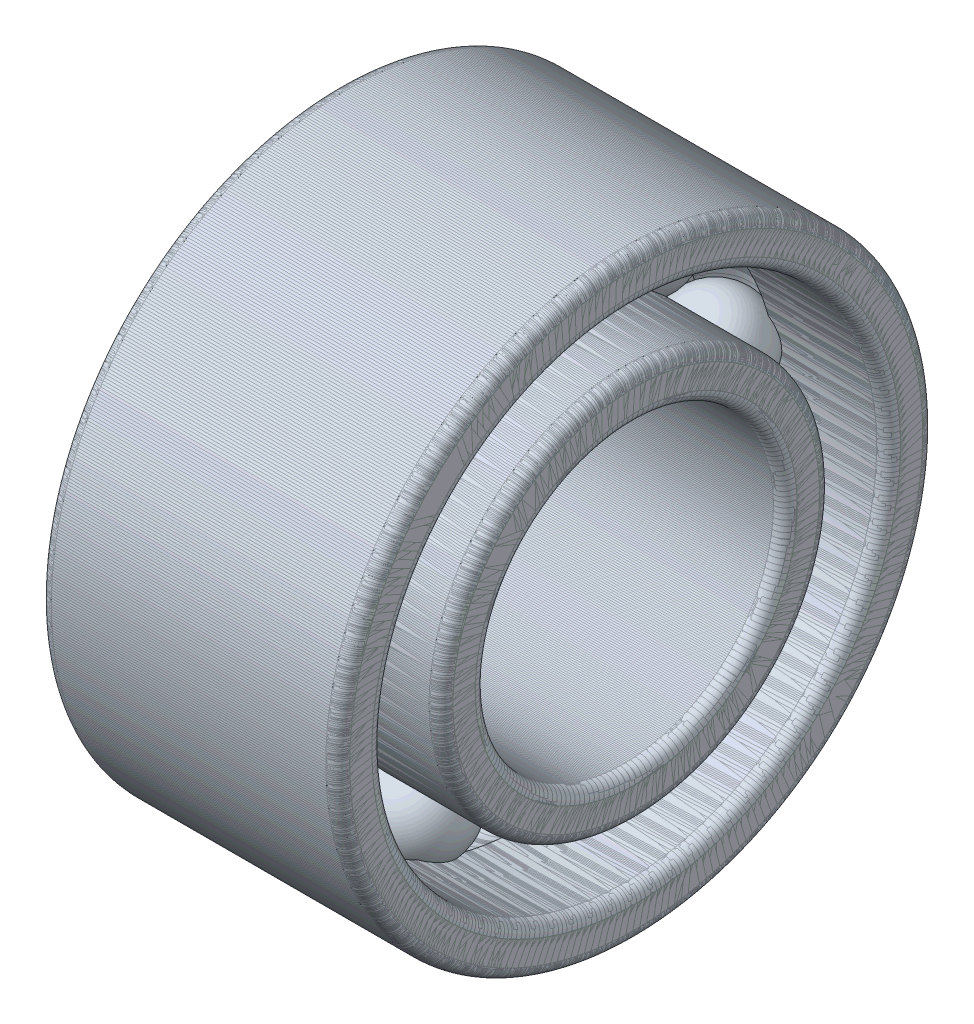
from build123d import *

# Parameters (mm, degrees)
SKETCH1_R             = 31.75
SKETCH1_R_2           = 26.8605
BOSS_EXTRUDE1_DEPTH   = 15.875
SKETCH1_R_3           = 20.765
SKETCH1_R_4           = 15.875
BOSS_EXTRUDE1_2_DEPTH = 15.875
FILLET1_R             = 1.27
FILLET2_R             = 1.27
SKETCH2_R             = 5.08
CIRPATTERN1_COUNT     = 9


with BuildPart() as part:
    # Sketch1 → Boss-Extrude1 (new, symmetric)
    with BuildSketch(Plane(origin=(0, 0, 0), x_dir=(0, 0, -1), z_dir=(1, 0, 0))):
        Circle(SKETCH1_R)
        Circle(SKETCH1_R_2, mode=Mode.SUBTRACT)
    extrude(amount=BOSS_EXTRUDE1_DEPTH, both=True)

    # Fillet1
    fillet1_edges = [part.edges().sort_by_distance(p)[0] for p in [
        (15.875, 0, 31.75),
        (-15.875, 0, 31.75),
        (-15.875, 0, 26.8605),
        (15.875, 0, 26.8605),
    ]]
    fillet(fillet1_edges, radius=FILLET1_R)


with BuildPart() as body_2:
    # Sketch1 → Boss-Extrude1 2 (new, symmetric)
    with BuildSketch(Plane(origin=(0, 0, 0), x_dir=(0, 0, -1), z_dir=(1, 0, 0))):
        Circle(SKETCH1_R_3)
        Circle(SKETCH1_R_4, mode=Mode.SUBTRACT)
    extrude(amount=BOSS_EXTRUDE1_2_DEPTH, both=True)

    # Fillet2
    fillet2_edges = [body_2.edges().sort_by_distance(p)[0] for p in [
        (15.875, 0, 20.765),
        (-15.875, 0, 20.765),
        (-15.875, 0, 15.875),
        (15.875, 0, 15.875),
    ]]
    fillet(fillet2_edges, radius=FILLET2_R)


with BuildPart() as cut_revolve1_tool:
    # Sketch2 → Cut-Revolve1 (revolve)
    with BuildSketch(Plane.XY):
        with Locations((0, 23.813)):
            Circle(SKETCH2_R)
    revolve(axis=Axis((0, 0, 0), (1, 0, 0)))


with BuildPart() as part_1:
    add(part.part)

    # Cut-Revolve1: cut by cut_revolve1_tool
    add(cut_revolve1_tool.part, mode=Mode.SUBTRACT)



with BuildPart() as body_2_1:
    add(body_2.part)

    # Cut-Revolve1: cut by cut_revolve1_tool
    add(cut_revolve1_tool.part, mode=Mode.SUBTRACT)


with BuildPart() as part_2:
    add(part_1.part)

    add(body_2_1.part)  # Revolve1 merges body 2
    # Sketch3 → Revolve1 (revolve)
    with BuildSketch(Plane.XY):
        with BuildLine():
            Line((0.792000564, 28.893), (0.792000564, 18.733))
            ThreePointArc((0.792000564, 18.733), (-4.287999436, 23.813), (0.792000564, 28.893))
        make_face()
    revolve(axis=Axis((0.792000564, 28.893, 0), (0, -1, 0)))


with BuildPart() as cirpattern1_1:
    # CirPattern1: pattern copy
    add(part_2.part.rotate(Axis((0, 0, 0), (1, 0, 0)), 1 * 360 / CIRPATTERN1_COUNT))


with BuildPart() as cirpattern1_2:
    # CirPattern1: pattern copy
    add(part_2.part.rotate(Axis((0, 0, 0), (1, 0, 0)), 2 * 360 / CIRPATTERN1_COUNT))


with BuildPart() as cirpattern1_3:
    # CirPattern1: pattern copy
    add(part_2.part.rotate(Axis((0, 0, 0), (1, 0, 0)), 3 * 360 / CIRPATTERN1_COUNT))


with BuildPart() as cirpattern1_4:
    # CirPattern1: pattern copy
    add(part_2.part.rotate(Axis((0, 0, 0), (1, 0, 0)), 4 * 360 / CIRPATTERN1_COUNT))


with BuildPart() as cirpattern1_5:
    # CirPattern1: pattern copy
    add(part_2.part.rotate(Axis((0, 0, 0), (1, 0, 0)), 5 * 360 / CIRPATTERN1_COUNT))


with BuildPart() as cirpattern1_6:
    # CirPattern1: pattern copy
    add(part_2.part.rotate(Axis((0, 0, 0), (1, 0, 0)), 6 * 360 / CIRPATTERN1_COUNT))


with BuildPart() as cirpattern1_7:
    # CirPattern1: pattern copy
    add(part_2.part.rotate(Axis((0, 0, 0), (1, 0, 0)), 7 * 360 / CIRPATTERN1_COUNT))


with BuildPart() as cirpattern1_8:
    # CirPattern1: pattern copy
    add(part_2.part.rotate(Axis((0, 0, 0), (1, 0, 0)), 8 * 360 / CIRPATTERN1_COUNT))


solid = Compound([part_2.part, cirpattern1_1.part, cirpattern1_2.part, cirpattern1_3.part, cirpattern1_4.part, cirpattern1_5.part, cirpattern1_6.part, cirpattern1_7.part, cirpattern1_8.part])
